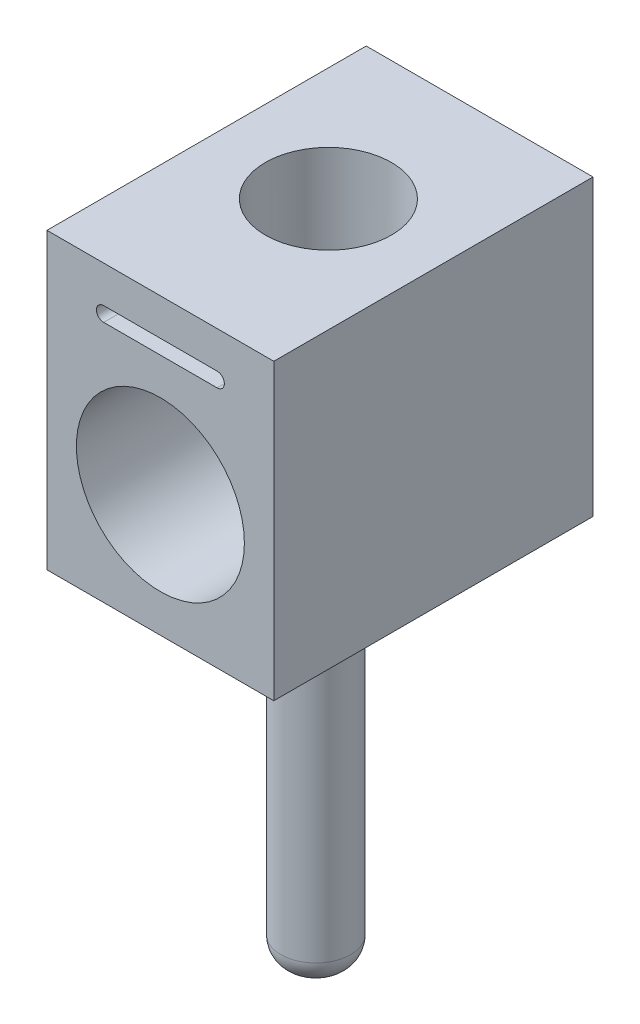
from build123d import *

# Parameters (mm, degrees)
SKETCH_1_W           = 2.7
SKETCH_1_H           = 3.5
EXTRUDE_1_DEPTH      = 3.8
SKETCH_2_OUTSIDE_W   = 5.866
SKETCH_2_OUTSIDE_H   = 6.666
SKETCH_2_OUTSIDE_W_2 = 2.7
SKETCH_2_OUTSIDE_H_2 = 3.5
SKETCH_2_OUTSIDE_R   = 1
CUT_EXTRUDE_1_DEPTH  = 5.396020928
SKETCH_4_OUTSIDE_W   = 5.866
SKETCH_4_OUTSIDE_H   = 6.966
SKETCH_4_OUTSIDE_W_2 = 2.7
SKETCH_4_OUTSIDE_H_2 = 3.8
SKETCH_4_OUTSIDE_R   = 0.75
CUT_EXTRUDE_2_DEPTH  = 1.85
CUT_EXTRUDE_3_DEPTH  = 0.5
SKETCH_6_R           = 0.415
EXTRUDE_2_DEPTH      = 4.31
FILLET_1_R           = 0.3
FILLET_2_R           = 0.1


with BuildPart() as part:
    # Эскиз1 → Бобышка-Вытянуть1 (new body)
    with BuildSketch(Plane.XY):
        Rectangle(SKETCH_1_W, SKETCH_1_H)
    extrude(amount=-EXTRUDE_1_DEPTH)

    # Эскиз2 outside → Вырез-Вытянуть1 (cut, through all)
    # profile 1 of 2: a face of its own
    with BuildSketch(Plane.XY):
        Rectangle(SKETCH_2_OUTSIDE_W, SKETCH_2_OUTSIDE_H)
        Rectangle(SKETCH_2_OUTSIDE_W_2, SKETCH_2_OUTSIDE_H_2, mode=Mode.SUBTRACT)
    # profile 2 of 2: a face of its own
    with BuildSketch(Plane.XY):
        with Locations((0, -0.3)):
            Circle(SKETCH_2_OUTSIDE_R)
    extrude(amount=-CUT_EXTRUDE_1_DEPTH, mode=Mode.SUBTRACT)

    # Эскиз4 outside → Вырез-Вытянуть2 (cut)
    # profile 1 of 2: a face of its own
    with BuildSketch(Plane(origin=(0, 1.75, 0), x_dir=(1, 0, 0), z_dir=(0, 1, 0))):
        with Locations((0, 1.9)):
            Rectangle(SKETCH_4_OUTSIDE_W, SKETCH_4_OUTSIDE_H)
        with Locations((0, 1.9)):
            Rectangle(SKETCH_4_OUTSIDE_W_2, SKETCH_4_OUTSIDE_H_2, mode=Mode.SUBTRACT)
    # profile 2 of 2: a face of its own
    with BuildSketch(Plane(origin=(0, 1.75, 0), x_dir=(1, 0, 0), z_dir=(0, 1, 0))):
        with Locations(Location((0, 2, 0), (0, 0, 270))):
            Circle(SKETCH_4_OUTSIDE_R)
    extrude(amount=-CUT_EXTRUDE_2_DEPTH, mode=Mode.SUBTRACT)

    # Эскиз5 → Вырез-Вытянуть3 (cut)
    with BuildSketch(Plane.XY):
        with BuildLine():
            Line((-0.675, 1.311413609), (0.675, 1.311413609))
            ThreePointArc((0.675, 1.311413609), (0.761413609, 1.225), (0.675, 1.138586391))
            Line((0.675, 1.138586391), (-0.675, 1.138586391))
            ThreePointArc((-0.675, 1.138586391), (-0.761413609, 1.225), (-0.675, 1.311413609))
        make_face()
    extrude(amount=-CUT_EXTRUDE_3_DEPTH, mode=Mode.SUBTRACT)

    # Эскиз6 → Бобышка-Вытянуть2 (add)
    with BuildSketch(Plane.XZ.offset(1.75)):
        with Locations(Location((0, -1.85, 0), (0, 0, 270))):
            Circle(SKETCH_6_R)
    extrude(amount=EXTRUDE_2_DEPTH)

    # Скругление1
    fillet_1_edges = [part.edges().sort_by_distance(p)[0] for p in [
        (0, -6.06, -1.435),
    ]]
    fillet(fillet_1_edges, radius=FILLET_1_R)

    # Скругление2
    fillet_2_edges = [part.edges().sort_by_distance(p)[0] for p in [
        (0, -1.75, -1.435),
    ]]
    fillet(fillet_2_edges, radius=FILLET_2_R)


solid = part.part
